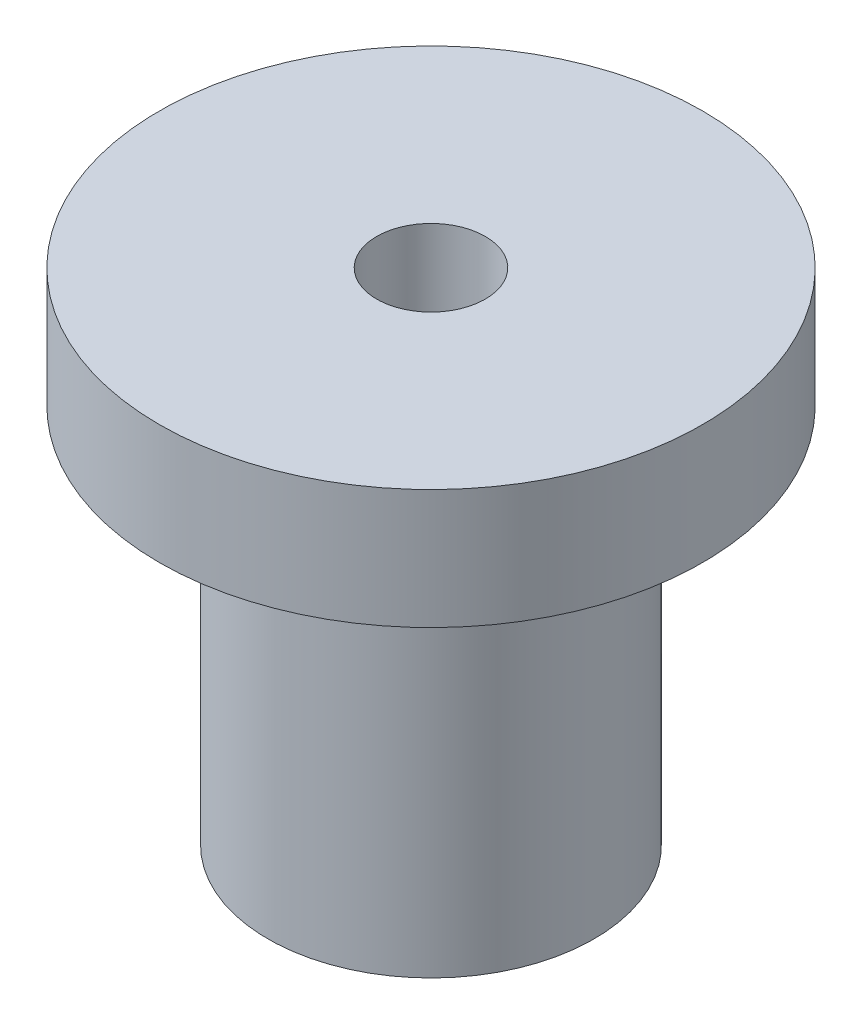
from build123d import *


with BuildPart() as part:
    # Sketch1 → Revolve1 (revolve)
    with BuildSketch(Plane.XY, mode=Mode.PRIVATE) as revolve1_sk:
        Polygon((25, 0), (75, 0), (75, 175), (125, 175), (125, 230), (25, 230), align=None)
    revolve(revolve1_sk.sketch.rotate(Axis((0, 0, 0), (0, 1, 0)), 90), axis=Axis((0, 0, 0), (0, 1, 0)))


solid = part.part
